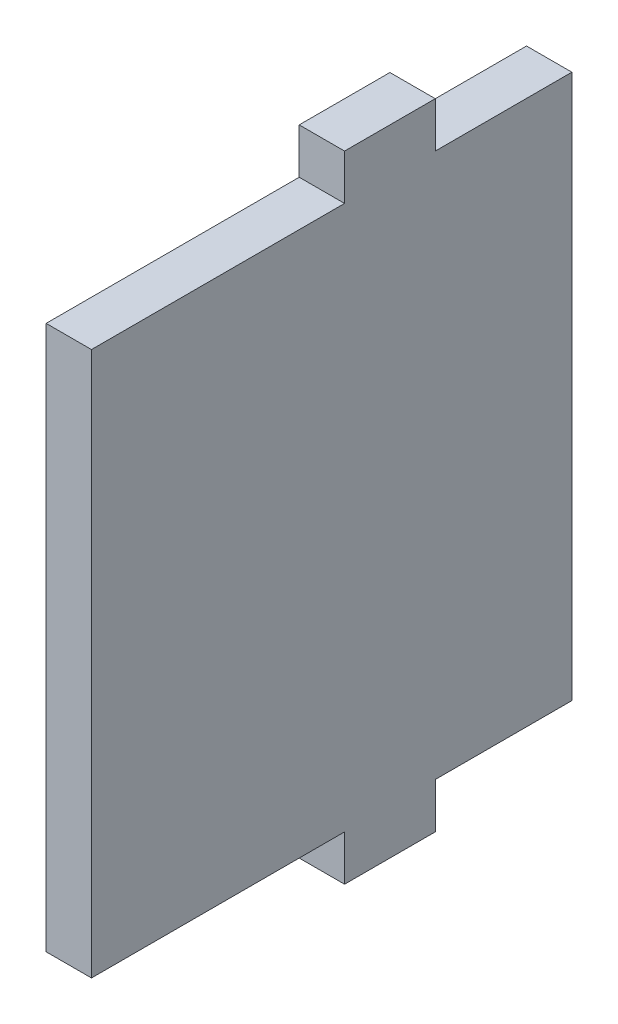
from build123d import *

# Parameters (mm, degrees)
BOSS_EXTRUDE4_DEPTH = 2.5


with BuildPart() as part:
    # Sketch1<5> → Boss-Extrude4 (new body)
    with BuildSketch(Plane(origin=(0, 0, 0), x_dir=(0, 0, -1), z_dir=(1, 0, 0))):
        Polygon((-16.45, -15), (-2.5, -15), (-2.5, -17.5), (2.5, -17.5), (2.5, -15), (10.03, -15), (10.03, 15), (2.5, 15), (2.5, 17.5), (-2.5, 17.5), (-2.5, 15), (-16.45, 15), align=None)
    extrude(amount=BOSS_EXTRUDE4_DEPTH)


solid = part.part
